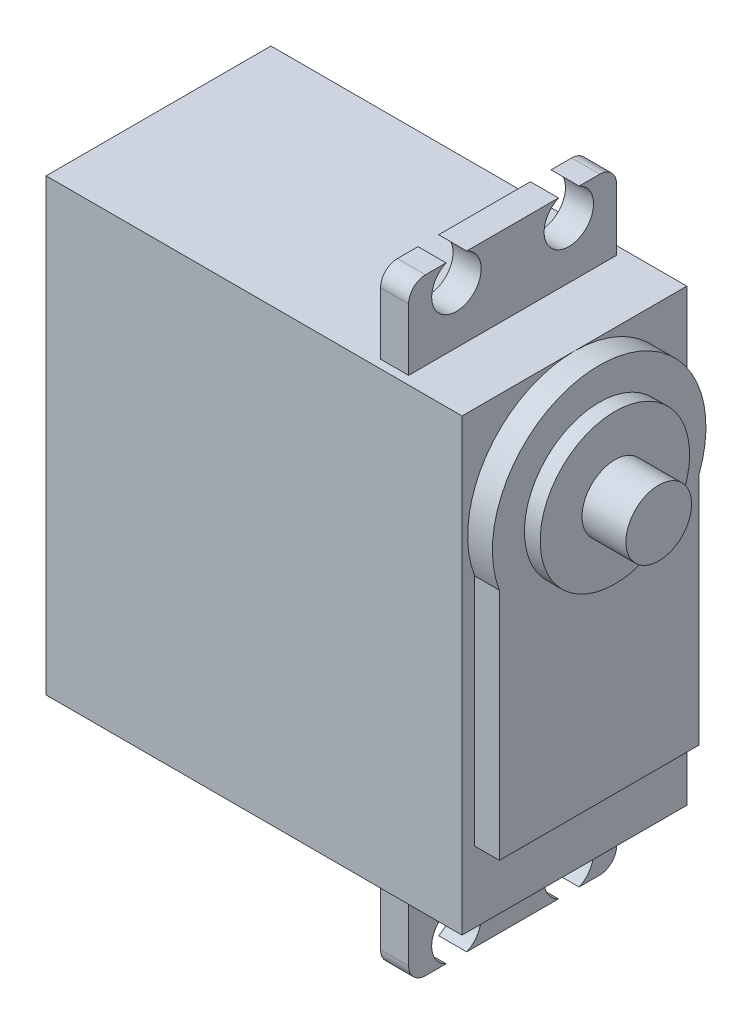
from build123d import *

# Parameters (mm, degrees)
SKETCH1_W           = 37
SKETCH1_H           = 40
BOSS_EXTRUDE1_DEPTH = 20
SKETCH2_W           = 18.5
SKETCH2_H           = 54
BOSS_EXTRUDE2_DEPTH = 2.5
FILLET1_R           = 1.5
CUT_EXTRUDE1_REACH  = 48.057
SKETCH3_R           = 2.2
SKETCH4_R           = 9.5
BOSS_EXTRUDE3_DEPTH = 2.2
SKETCH5_W           = 17.75
SKETCH5_H           = 23.804167323
BOSS_EXTRUDE4_DEPTH = 2.2
SKETCH6_R           = 6.65
BOSS_EXTRUDE5_DEPTH = 1.4
SKETCH7_R           = 2.925
BOSS_EXTRUDE6_DEPTH = 3.9


with BuildPart() as part:
    # Sketch1 → Boss-Extrude1 (new body)
    with BuildSketch(Plane.XY):
        Rectangle(SKETCH1_W, SKETCH1_H)
    extrude(amount=-BOSS_EXTRUDE1_DEPTH)

    # Sketch2 → Boss-Extrude2 (add)
    with BuildSketch(Plane.ZY.offset(-10.5)):
        with Locations((-10, 0)):
            Rectangle(SKETCH2_W, SKETCH2_H)
    extrude(amount=-BOSS_EXTRUDE2_DEPTH)

    # Fillet1
    fillet1_edges = [part.edges().sort_by_distance(p)[0] for p in [
        (11.75, -27, -19.25),
        (11.75, 27, -0.75),
        (11.75, -27, -0.75),
        (11.75, 27, -19.25),
    ]]
    fillet(fillet1_edges, radius=FILLET1_R)

    # Sketch3 → Cut-Extrude1 (cut, up to next)
    with BuildSketch(Plane(origin=(13, 0, 0), x_dir=(0, 0, -1), z_dir=(1, 0, 0)), mode=Mode.PRIVATE) as cut_extrude1_sk1:
        with Locations((5, 25)):
            Circle(SKETCH3_R)
    cut_extrude1_tool1 = extrude(cut_extrude1_sk1.sketch, amount=-CUT_EXTRUDE1_REACH, mode=Mode.PRIVATE) & part.part
    # Sketch3 → Cut-Extrude1 (cut, up to next)
    with BuildSketch(Plane(origin=(13, 0, 0), x_dir=(0, 0, -1), z_dir=(1, 0, 0)), mode=Mode.PRIVATE) as cut_extrude1_sk2:
        with Locations((15, 25)):
            Circle(SKETCH3_R)
    cut_extrude1_tool2 = extrude(cut_extrude1_sk2.sketch, amount=-CUT_EXTRUDE1_REACH, mode=Mode.PRIVATE) & part.part
    # Sketch3 → Cut-Extrude1 (cut, up to next)
    with BuildSketch(Plane(origin=(13, 0, 0), x_dir=(0, 0, -1), z_dir=(1, 0, 0)), mode=Mode.PRIVATE) as cut_extrude1_sk3:
        with Locations((5, -25)):
            Circle(SKETCH3_R)
    cut_extrude1_tool3 = extrude(cut_extrude1_sk3.sketch, amount=-CUT_EXTRUDE1_REACH, mode=Mode.PRIVATE) & part.part
    # Sketch3 → Cut-Extrude1 (cut, up to next)
    with BuildSketch(Plane(origin=(13, 0, 0), x_dir=(0, 0, -1), z_dir=(1, 0, 0)), mode=Mode.PRIVATE) as cut_extrude1_sk4:
        with Locations((15, -25)):
            Circle(SKETCH3_R)
    cut_extrude1_tool4 = extrude(cut_extrude1_sk4.sketch, amount=-CUT_EXTRUDE1_REACH, mode=Mode.PRIVATE) & part.part
    add(cut_extrude1_tool1.solids().sort_by_distance((13, 25, -5))[0], mode=Mode.SUBTRACT)
    add(cut_extrude1_tool2.solids().sort_by_distance((13, 25, -15))[0], mode=Mode.SUBTRACT)
    add(cut_extrude1_tool3.solids().sort_by_distance((13, -25, -5))[0], mode=Mode.SUBTRACT)
    add(cut_extrude1_tool4.solids().sort_by_distance((13, -25, -15))[0], mode=Mode.SUBTRACT)

    # Sketch4 → Boss-Extrude3 (add)
    with BuildSketch(Plane(origin=(18.5, 0, 0), x_dir=(0, 0, -1), z_dir=(1, 0, 0))):
        with Locations(Location((10, 10.5, 0), (0, 0, 90))):
            Circle(SKETCH4_R)
    extrude(amount=BOSS_EXTRUDE3_DEPTH)

    # Sketch5 → Boss-Extrude4 (add)
    with BuildSketch(Plane(origin=(18.5, 0, 0), x_dir=(0, 0, -1), z_dir=(1, 0, 0))):
        with Locations((10, -1.797916339)):
            Rectangle(SKETCH5_W, SKETCH5_H)
    extrude(amount=BOSS_EXTRUDE4_DEPTH)

    # Sketch6 → Boss-Extrude5 (add)
    with BuildSketch(Plane(origin=(20.7, 0, 0), x_dir=(0, 0, -1), z_dir=(1, 0, 0))):
        with Locations((10, 10.5)):
            Circle(SKETCH6_R)
    extrude(amount=BOSS_EXTRUDE5_DEPTH)

    # Sketch7 → Boss-Extrude6 (add)
    with BuildSketch(Plane(origin=(22.1, 0, 0), x_dir=(0, 0, -1), z_dir=(1, 0, 0))):
        with Locations((10, 10.5)):
            Circle(SKETCH7_R)
    extrude(amount=BOSS_EXTRUDE6_DEPTH)


solid = part.part
